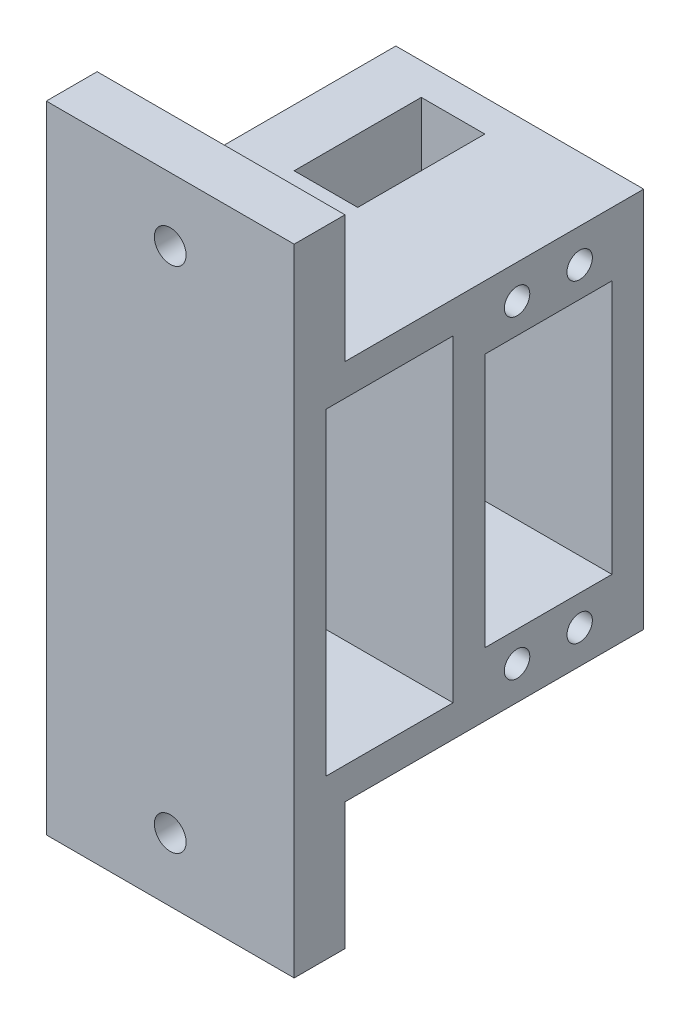
from build123d import *

# Parameters (mm, degrees)
SKETCH1_W           = 30
SKETCH1_H           = 60
BOSS_EXTRUDE1_DEPTH = 39
SKETCH2_W           = 20
SKETCH2_H           = 40
CUT_EXTRUDE1_DEPTH  = 30
SKETCH3_R           = 2
CUT_EXTRUDE2_DEPTH  = 20
SKETCH4_W           = 10
SKETCH4_H           = 20
CUT_EXTRUDE3_DEPTH  = 10
SKETCH5_W           = 39
SKETCH5_H           = 60
BOSS_EXTRUDE2_DEPTH = 25
SKETCH6_W           = 20
SKETCH6_H           = 50
CUT_EXTRUDE4_DEPTH  = 39
SKETCH7_W           = 39
SKETCH7_H           = 8
BOSS_EXTRUDE3_DEPTH = 20
SKETCH8_W           = 39
SKETCH8_H           = 8
BOSS_EXTRUDE4_DEPTH = 20
SKETCH9_R           = 2.5
CUT_EXTRUDE5_DEPTH  = 8


with BuildPart() as part:
    # Sketch1 → Boss-Extrude1 (new body)
    with BuildSketch(Plane(origin=(0, 0, 0), x_dir=(0, 0, -1), z_dir=(1, 0, 0))):
        Rectangle(SKETCH1_W, SKETCH1_H)
    extrude(amount=BOSS_EXTRUDE1_DEPTH)

    # Sketch2 → Cut-Extrude1 (cut)
    with BuildSketch(Plane(origin=(39, 0, 0), x_dir=(0, 0, -1), z_dir=(1, 0, 0))):
        Rectangle(SKETCH2_W, SKETCH2_H)
    extrude(amount=-CUT_EXTRUDE1_DEPTH, mode=Mode.SUBTRACT)

    # Sketch3 → Cut-Extrude2 (cut)
    with BuildSketch(Plane(origin=(39, 0, 0), x_dir=(0, 0, -1), z_dir=(1, 0, 0))):
        with Locations((-4.925, 24.71)):
            Circle(SKETCH3_R)
        with Locations((4.925, 24.71)):
            Circle(SKETCH3_R)
        with Locations(Location((4.925, -24.71, 0), (0, 0, 180))):
            Circle(SKETCH3_R)
        with Locations(Location((-4.925, -24.71, 0), (0, 0, 180))):
            Circle(SKETCH3_R)
    extrude(amount=-CUT_EXTRUDE2_DEPTH, mode=Mode.SUBTRACT)

    # Sketch4 → Cut-Extrude3 (cut)
    with BuildSketch(Plane.XZ.offset(-20)):
        with Locations((14, 0)):
            Rectangle(SKETCH4_W, SKETCH4_H)
    extrude(amount=-CUT_EXTRUDE3_DEPTH, mode=Mode.SUBTRACT)

    # Sketch5 → Boss-Extrude2 (add)
    with BuildSketch(Plane.XY.offset(15)):
        with Locations((19.5, 0)):
            Rectangle(SKETCH5_W, SKETCH5_H)
    extrude(amount=BOSS_EXTRUDE2_DEPTH)

    # Sketch6 → Cut-Extrude4 (cut)
    with BuildSketch(Plane(origin=(39, 0, 0), x_dir=(0, 0, -1), z_dir=(1, 0, 0))):
        with Locations((-25, 0)):
            Rectangle(SKETCH6_W, SKETCH6_H)
    extrude(amount=-CUT_EXTRUDE4_DEPTH, mode=Mode.SUBTRACT)

    # Sketch7 → Boss-Extrude3 (add)
    with BuildSketch(Plane(origin=(0, -30, 0), x_dir=(-1, 0, 0), z_dir=(0, -1, 0))):
        with Locations((-19.5, -36)):
            Rectangle(SKETCH7_W, SKETCH7_H)
    extrude(amount=BOSS_EXTRUDE3_DEPTH)

    # Sketch8 → Boss-Extrude4 (add)
    with BuildSketch(Plane(origin=(0, 30, 0), x_dir=(1, 0, 0), z_dir=(0, 1, 0))):
        with Locations((19.5, -36)):
            Rectangle(SKETCH8_W, SKETCH8_H)
    extrude(amount=BOSS_EXTRUDE4_DEPTH)

    # Sketch9 → Cut-Extrude5 (cut)
    with BuildSketch(Plane(origin=(0, 0, 32), x_dir=(-1, 0, 0), z_dir=(0, 0, -1))):
        with Locations((-19.5, -40)):
            Circle(SKETCH9_R)
        with Locations((-19.5, 40)):
            Circle(SKETCH9_R)
    extrude(amount=-CUT_EXTRUDE5_DEPTH, mode=Mode.SUBTRACT)


solid = part.part
